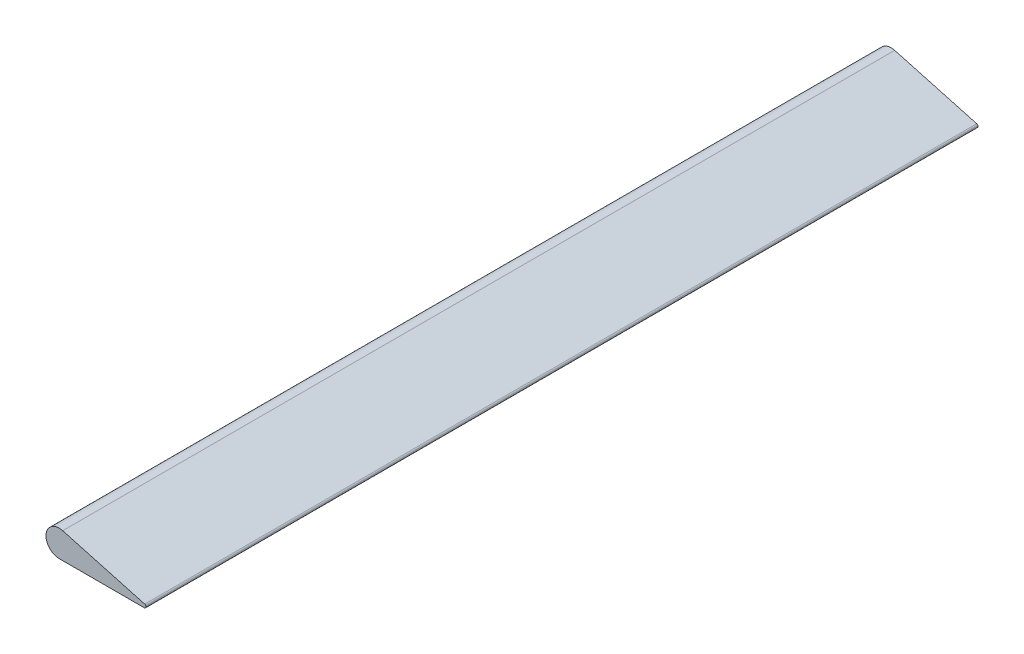
from build123d import *

# Parameters (mm, degrees)
BOSS_EXTRUDE1_DEPTH = 238
SKETCH3_W           = 15
SKETCH3_H           = 15
CUT_EXTRUDE1_DEPTH  = 54
FILLET1_R           = 0.5


with BuildPart() as part:
    # Sketch2 → Boss-Extrude1 (new body)
    with BuildSketch(Plane.XY.offset(-3)):
        with BuildLine():
            Line((446.391965645, 20.11245238), (474.43313548, 20.11245238))
            Line((474.43313548, 20.11245238), (447.390900992, 27.530319971))
            ThreePointArc((447.390900992, 27.530319971), (442.649552271, 24.39262378), (446.391965645, 20.11245238))
        make_face()
    extrude(amount=BOSS_EXTRUDE1_DEPTH)

    # Sketch3 → Cut-Extrude1 (cut)
    with BuildSketch(Plane.XZ.offset(30.589717262)):
        with Locations((450.115770482, 182.5)):
            Rectangle(SKETCH3_W, SKETCH3_H)
        with Locations((450.115770482, 49.5)):
            Rectangle(SKETCH3_W, SKETCH3_H)
    extrude(amount=-CUT_EXTRUDE1_DEPTH, mode=Mode.SUBTRACT)

    # Fillet1
    fillet1_edges = [part.edges().sort_by_distance(p)[0] for p in [
        (474.43313548, 20.11245238, 116),
    ]]
    fillet(fillet1_edges, radius=FILLET1_R)


solid = part.part
